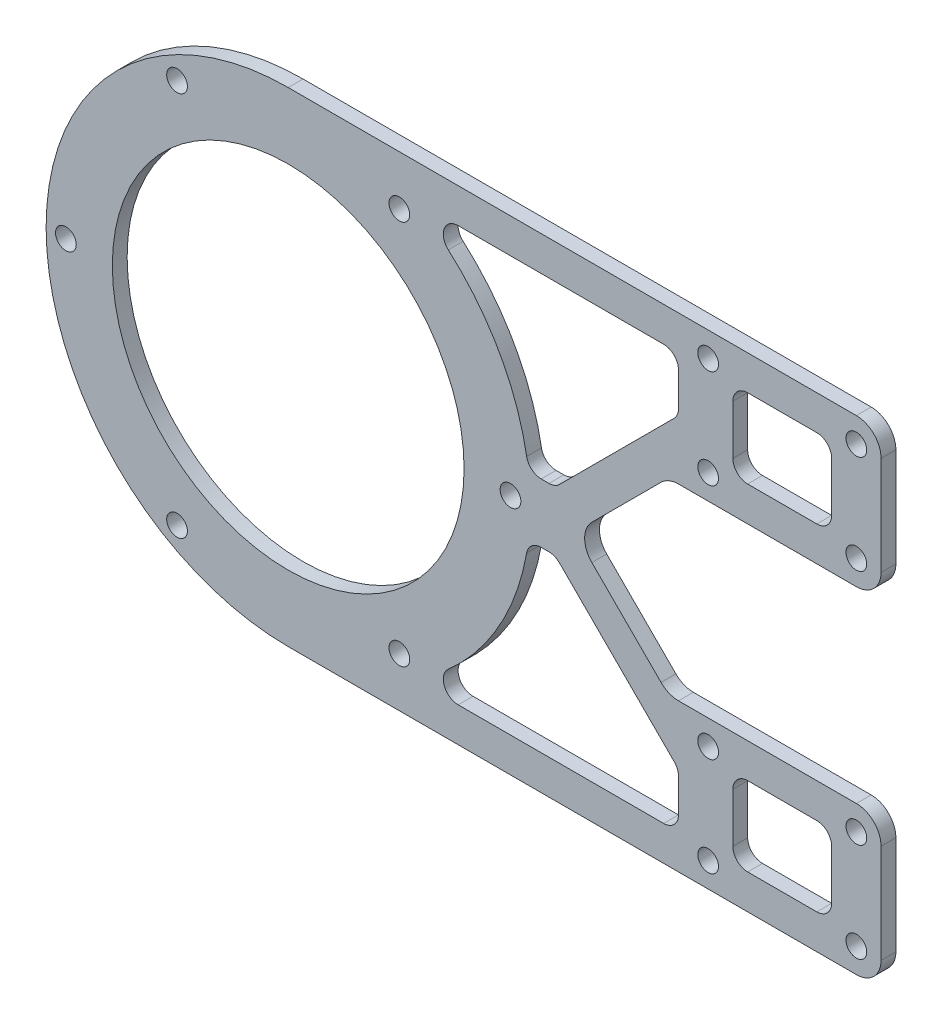
from build123d import *

# Parameters (mm, degrees)
SKETCH_1_R          = 2.1
SKETCH_1_R_2        = 35.6
EXTRUDE_1_DEPTH     = 3
SKETCH_2_R          = 2.1
CUT_EXTRUDE_1_DEPTH = 3
CUT_EXTRUDE_2_DEPTH = 130.653384067


with BuildPart() as part:
    # 草图1 → 凸台-拉伸1 (new body)
    with BuildSketch(Plane.XY):
        with BuildLine():
            Line((0, 49), (115, 49))
            ThreePointArc((115, 49), (118.535533906, 47.535533906), (120, 44))
            Line((120, 44), (120, 24))
            ThreePointArc((120, 24), (118.535533906, 20.464466094), (115, 19))
            Line((115, 19), (79, 19))
            ThreePointArc((79, 19), (77.086582838, 18.619397663), (75.464466094, 17.535533906))
            Line((75.464466094, 17.535533906), (61.464466094, 3.535533906))
            ThreePointArc((61.464466094, 3.535533906), (60, 0), (61.464466094, -3.535533906))
            Line((61.464466094, -3.535533906), (75.464466094, -17.535533906))
            ThreePointArc((75.464466094, -17.535533906), (77.086582838, -18.619397663), (79, -19))
            Line((79, -19), (115, -19))
            ThreePointArc((115, -19), (118.535533906, -20.464466094), (120, -24))
            Line((120, -24), (120, -44))
            ThreePointArc((120, -44), (118.535533906, -47.535533906), (115, -49))
            Line((115, -49), (0, -49))
            ThreePointArc((0, -49), (-49, 0), (0, 49))
        make_face()
        with Locations((-45, 0)):
            Circle(SKETCH_1_R, mode=Mode.SUBTRACT)
        with Locations((-22.5, 38.97114317)):
            Circle(SKETCH_1_R, mode=Mode.SUBTRACT)
        with Locations((22.5, 38.97114317)):
            Circle(SKETCH_1_R, mode=Mode.SUBTRACT)
        with Locations((45, 0)):
            Circle(SKETCH_1_R, mode=Mode.SUBTRACT)
        with Locations((22.5, -38.97114317)):
            Circle(SKETCH_1_R, mode=Mode.SUBTRACT)
        with Locations((-22.5, -38.97114317)):
            Circle(SKETCH_1_R, mode=Mode.SUBTRACT)
        Circle(SKETCH_1_R_2, mode=Mode.SUBTRACT)
    extrude(amount=EXTRUDE_1_DEPTH)

    # 草图2 → 切除-拉伸1 (cut)
    with BuildSketch(Plane.XY):
        with Locations((85, 44)):
            Circle(SKETCH_2_R)
        with Locations((115, 44)):
            Circle(SKETCH_2_R)
        with Locations(Location((115, 24, 0), (0, 0, 180))):
            Circle(SKETCH_2_R)
        with Locations(Location((85, 24, 0), (0, 0, 180))):
            Circle(SKETCH_2_R)
        with Locations((85, -24)):
            Circle(SKETCH_2_R)
        with Locations((115, -24)):
            Circle(SKETCH_2_R)
        with Locations(Location((115, -44, 0), (0, 0, 180))):
            Circle(SKETCH_2_R)
        with Locations(Location((85, -44, 0), (0, 0, 180))):
            Circle(SKETCH_2_R)
    extrude(amount=CUT_EXTRUDE_1_DEPTH, mode=Mode.SUBTRACT)

    # 草图3 → 切除-拉伸2 (cut, through all)
    with BuildSketch(Plane.XY):
        with BuildLine():
            Line((34.394767044, 42), (76, 42))
            ThreePointArc((76, 42), (78.121320344, 41.121320344), (79, 39))
            Line((79, 39), (79, 32.213203436))
            ThreePointArc((79, 32.213203436), (78.771638598, 31.065153139), (78.121320344, 30.091883092))
            Line((78.121320344, 30.091883092), (54.908116908, 6.878679656))
            ThreePointArc((54.908116908, 6.878679656), (53.934846861, 6.228361402), (52.786796564, 6))
            Line((52.786796564, 6), (51.215232109, 6))
            ThreePointArc((51.215232109, 6), (49.28620286, 6.702426029), (48.26050718, 8.480769231))
            ThreePointArc((48.26050718, 8.480769231), (42.740359483, 23.963757452), (32.410453561, 36.75))
            ThreePointArc((32.410453561, 36.75), (31.588524004, 40.060660172), (34.394767044, 42))
        make_face()
        with BuildLine():
            Line((52.786796564, -6), (51.215232109, -6))
            ThreePointArc((51.215232109, -6), (49.28620286, -6.702426029), (48.26050718, -8.480769231))
            ThreePointArc((48.26050718, -8.480769231), (42.740359483, -23.963757452), (32.410453561, -36.75))
            ThreePointArc((32.410453561, -36.75), (31.588524004, -40.060660172), (34.394767044, -42))
            Line((34.394767044, -42), (76, -42))
            ThreePointArc((76, -42), (78.121320344, -41.121320344), (79, -39))
            Line((79, -39), (79, -32.213203436))
            ThreePointArc((79, -32.213203436), (78.771638598, -31.065153139), (78.121320344, -30.091883092))
            Line((78.121320344, -30.091883092), (54.908116908, -6.878679656))
            ThreePointArc((54.908116908, -6.878679656), (53.934846861, -6.228361402), (52.786796564, -6))
        make_face()
        with BuildLine():
            Line((93, 26), (107, 26))
            ThreePointArc((107, 26), (109.121320344, 26.878679656), (110, 29))
            Line((110, 29), (110, 39))
            ThreePointArc((110, 39), (109.121320344, 41.121320344), (107, 42))
            Line((107, 42), (93, 42))
            ThreePointArc((93, 42), (90.878679656, 41.121320344), (90, 39))
            Line((90, 39), (90, 29))
            ThreePointArc((90, 29), (90.878679656, 26.878679656), (93, 26))
        make_face()
        with BuildLine():
            Line((110, -29), (110, -39))
            ThreePointArc((110, -39), (109.121320344, -41.121320344), (107, -42))
            Line((107, -42), (93, -42))
            ThreePointArc((93, -42), (90.878679656, -41.121320344), (90, -39))
            Line((90, -39), (90, -29))
            ThreePointArc((90, -29), (90.878679656, -26.878679656), (93, -26))
            Line((93, -26), (107, -26))
            ThreePointArc((107, -26), (109.121320344, -26.878679656), (110, -29))
        make_face()
    extrude(amount=CUT_EXTRUDE_2_DEPTH, mode=Mode.SUBTRACT)


solid = part.part
